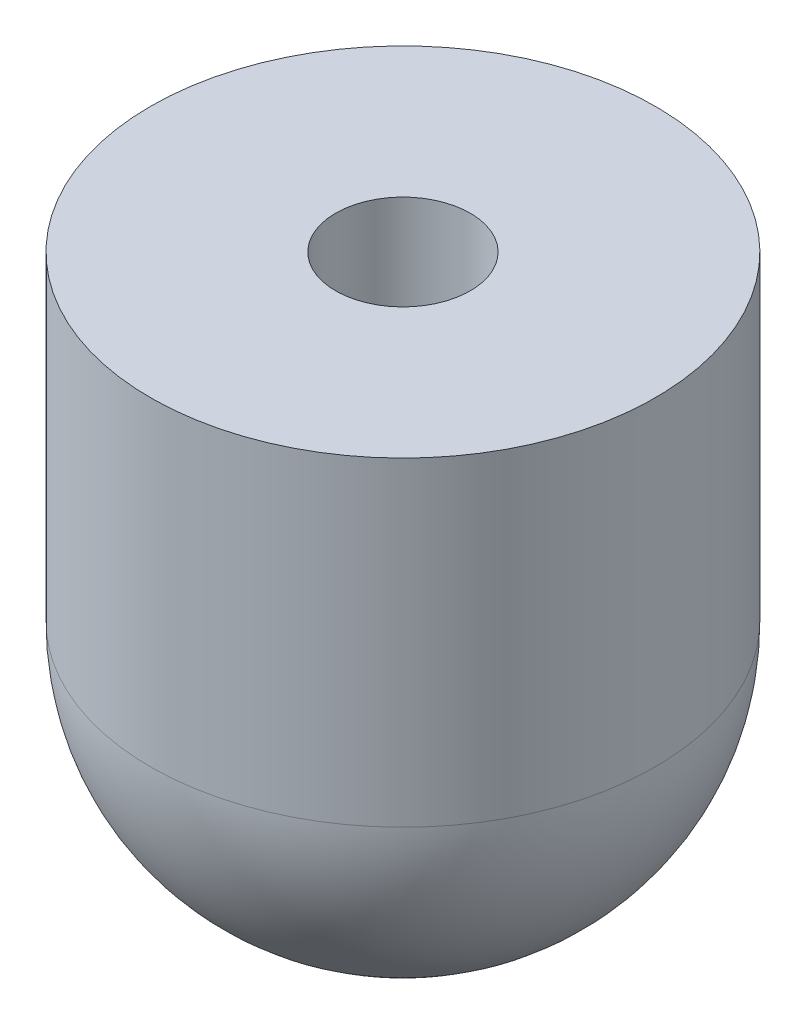
from build123d import *

# Parameters (mm, degrees)
CUT_EXTRUDE1_START = -3
CUT_EXTRUDE1_DEPTH = 3.5
CUT_EXTRUDE2_REACH = 22.037
SKETCH3_R          = 2


with BuildPart() as part:
    # Sketch1 → Revolve1 (revolve)
    with BuildSketch(Plane.XY):
        with BuildLine():
            Line((0, 0), (-7.5, 0))
            Line((-7.5, 0), (-7.5, -9.5))
            ThreePointArc((-7.5, -9.5), (-5.303300859, -14.803300859), (0, -17))
            Line((0, -17), (0, 0))
        make_face()
    revolve(axis=Axis((0, 0, 0), (0, -1, 0)))

    # Sketch2 → Cut-Extrude1 (cut)
    with BuildSketch(Plane(origin=(0, 0, 0), x_dir=(1, 0, 0), z_dir=(0, 1, 0)).offset(CUT_EXTRUDE1_START)):
        Polygon((3.6, -2.078460969), (3.6, 2.078460969), (0, 4.156921938), (-3.6, 2.078460969), (-3.6, -2.078460969), (0, -4.156921938), align=None)
    extrude(amount=-CUT_EXTRUDE1_DEPTH, mode=Mode.SUBTRACT)

    # Sketch3 → Cut-Extrude2 (cut, up to next)
    with BuildSketch(Plane(origin=(0, 0, 0), x_dir=(1, 0, 0), z_dir=(0, 1, 0)), mode=Mode.PRIVATE) as cut_extrude2_sk1:
        with Locations(Location((0, 0, 0), (0, 0, 180))):
            Circle(SKETCH3_R)
    cut_extrude2_tool1 = extrude(cut_extrude2_sk1.sketch, amount=-CUT_EXTRUDE2_REACH, mode=Mode.PRIVATE) & part.part
    add(cut_extrude2_tool1.solids().sort_by_distance((0, 0, 0))[0], mode=Mode.SUBTRACT)


solid = part.part
